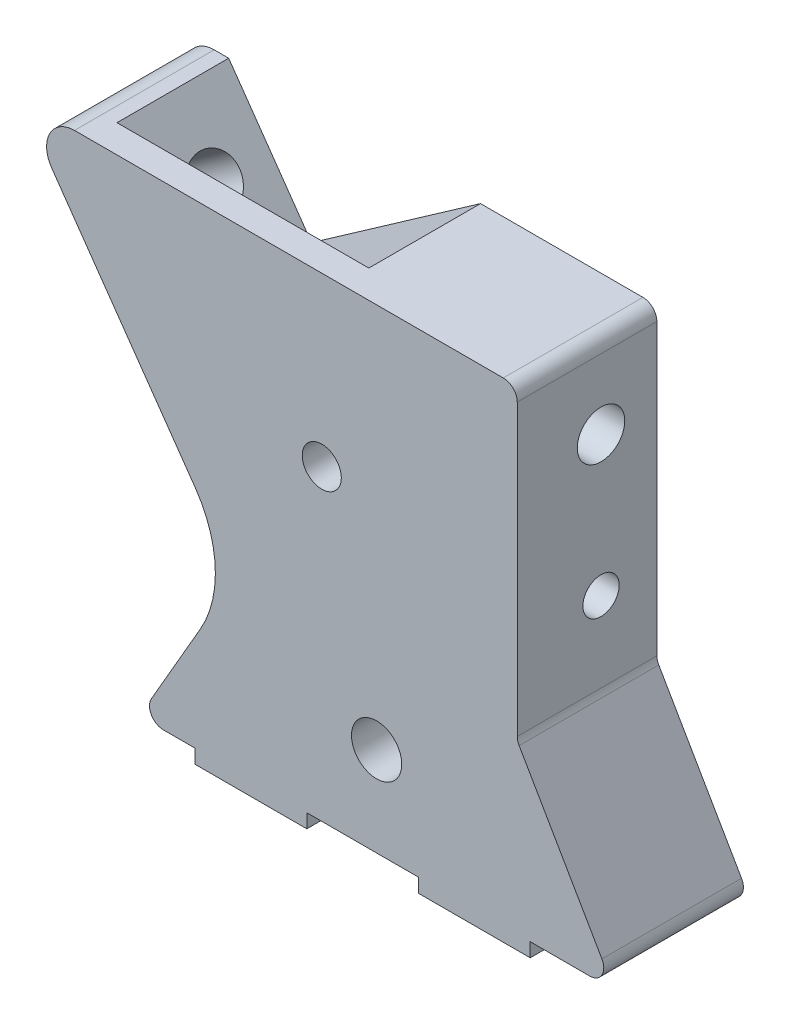
from build123d import *

# Parameters (mm, degrees)
BOSS_EXTRUDE1_DEPTH = 25
SKETCH5_R           = 3.25
SKETCH5_R_2         = 4.25
CUT_EXTRUDE2_DEPTH  = 15
SKETCH6_R           = 4.5
CUT_EXTRUDE3_DEPTH  = 93.883645912
CUT_EXTRUDE4_DEPTH  = 20
SKETCH8_W           = 20
SKETCH8_H           = 25
BOSS_EXTRUDE2_DEPTH = 2.5
SKETCH10_R          = 8.75
BOSS_EXTRUDE6_DEPTH = 5
SKETCH3_R           = 3.5
SKETCH3_R_2         = 4.5
CUT_EXTRUDE5_DEPTH  = 123.780291578
FILLET1_R           = 5
FILLET2_R           = 2.5


with BuildPart() as part:
    # Sketch1 → Boss-Extrude1 (new body)
    with BuildSketch(Plane.XY):
        with BuildLine():
            Line((0, 0), (85, 0))
            Line((85, 0), (67.679491924, 30))
            Line((67.679491924, 30), (67.679491924, 85))
            Line((67.679491924, 85), (-21.190906526, 85))
            Line((-21.190906526, 85), (10.012338278, 40.43714813))
            ThreePointArc((10.012338278, 40.43714813), (13.610261824, 29.83800715), (10.949805468, 18.965619403))
            Line((10.949805468, 18.965619403), (0, 0))
        make_face()
    extrude(amount=-BOSS_EXTRUDE1_DEPTH)

    # Sketch5 → Cut-Extrude2 (cut)
    with BuildSketch(Plane(origin=(67.679491924, 0, 0), x_dir=(0, 0, -1), z_dir=(1, 0, 0))):
        with Locations((15, 45)):
            Circle(SKETCH5_R)
        with Locations((15, 70)):
            Circle(SKETCH5_R_2)
    extrude(amount=-CUT_EXTRUDE2_DEPTH, mode=Mode.SUBTRACT)

    # Sketch6 → Cut-Extrude3 (cut, through all)
    with BuildSketch(Plane(origin=(25.717624677, 18.007674664, 0), x_dir=(0, 0, 1), z_dir=(-0.8191520442889889, -0.5735764363510502, 0))):
        with Locations(Location((-15, 61.782528413, 0), (0, 0, 270))):
            Circle(SKETCH6_R)
    extrude(amount=-CUT_EXTRUDE3_DEPTH, mode=Mode.SUBTRACT)

    # Sketch7 → Cut-Extrude4 (cut)
    with BuildSketch(Plane(origin=(0, 0, -25), x_dir=(-1, 0, 0), z_dir=(0, 0, -1))):
        Polygon((-57.679491924, 80), (-57.679491924, 32.5), (-21.673862174, 32.5), (-4.621853415, 56.85279232), (-37.679491924, 80), align=None)
        Polygon((-63.349364905, 27.5), (-76.339745962, 5), (-8.660254038, 5), (-21.650635095, 27.5), align=None)
        Polygon((-36.10299798, 85), (-5.849731455, 63.816434723), (8.983160638, 85), align=None)
    extrude(amount=-CUT_EXTRUDE4_DEPTH, mode=Mode.SUBTRACT)

    # Sketch8 → Boss-Extrude2 (add)
    with BuildSketch(Plane.XZ):
        with Locations((60, -12.5)):
            Rectangle(SKETCH8_W, SKETCH8_H)
        with Locations((20, -12.5)):
            Rectangle(SKETCH8_W, SKETCH8_H)
    extrude(amount=BOSS_EXTRUDE2_DEPTH)

    # Sketch10 → Boss-Extrude6 (add)
    with BuildSketch(Plane(origin=(0, 0, -5), x_dir=(-1, 0, 0), z_dir=(0, 0, -1))):
        with Locations((-32.679491924, 55)):
            Circle(SKETCH10_R)
        with Locations((-42.5, 16)):
            Circle(SKETCH10_R)
    extrude(amount=BOSS_EXTRUDE6_DEPTH)

    # Sketch3 → Cut-Extrude5 (cut, through all)
    with BuildSketch(Plane.XY):
        with Locations((32.679491924, 55)):
            Circle(SKETCH3_R)
        with Locations((42.5, 16)):
            Circle(SKETCH3_R_2)
    extrude(amount=-CUT_EXTRUDE5_DEPTH, mode=Mode.SUBTRACT)

    # Fillet1
    fillet1_edges = [part.edges().sort_by_distance(p)[0] for p in [
        (-21.190906526, 85, -12.5),
    ]]
    fillet(fillet1_edges, radius=FILLET1_R)

    # Fillet2
    fillet2_edges = [part.edges().sort_by_distance(p)[0] for p in [
        (0, 0, -12.5),
        (67.679491924, 30, -12.5),
        (85, 0, -12.5),
        (67.679491924, 85, -12.5),
    ]]
    fillet(fillet2_edges, radius=FILLET2_R)


solid = part.part
